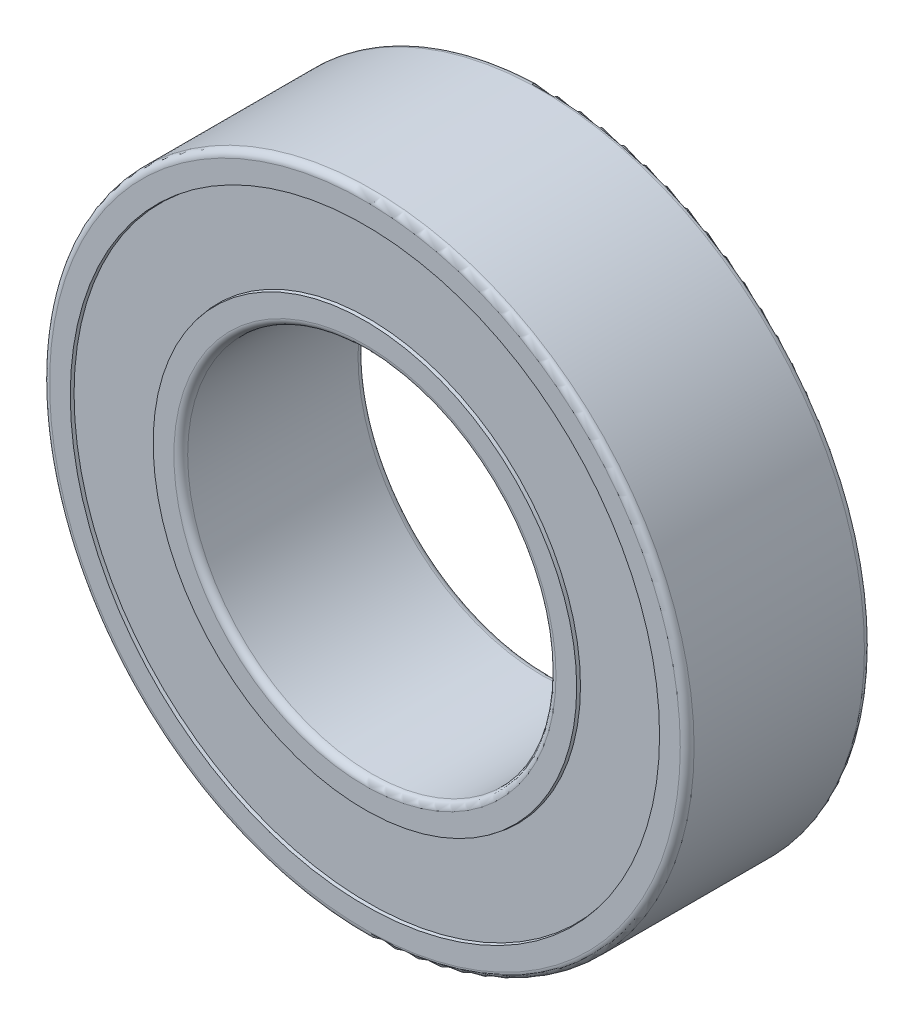
from build123d import *


with BuildPart() as part:
    # Sketch1 → Revolve1 (revolve)
    with BuildSketch(Plane(origin=(0, 0, 0), x_dir=(0, 0, -1), z_dir=(1, 0, 0)), mode=Mode.PRIVATE) as revolve1_sk:
        with BuildLine():
            Line((-1.85, 7), (1.85, 7))
            ThreePointArc((1.85, 7), (1.956066017, 6.956066017), (2, 6.85))
            Line((2, 6.85), (2, 6.4))
            Line((2, 6.4), (1.93, 6.387657111))
            Line((1.93, 6.387657111), (1.93, 4.612342889))
            Line((1.93, 4.612342889), (2, 4.6))
            Line((2, 4.6), (2, 4.15))
            ThreePointArc((2, 4.15), (1.956066017, 4.043933983), (1.85, 4))
            Line((1.85, 4), (-1.85, 4))
            ThreePointArc((-1.85, 4), (-1.956066017, 4.043933983), (-2, 4.15))
            Line((-2, 4.15), (-2, 4.6))
            Line((-2, 4.6), (-1.93, 4.612342889))
            Line((-1.93, 4.612342889), (-1.93, 6.387657111))
            Line((-1.93, 6.387657111), (-2, 6.4))
            Line((-2, 6.4), (-2, 6.85))
            ThreePointArc((-2, 6.85), (-1.956066017, 6.956066017), (-1.85, 7))
        make_face()
    revolve(revolve1_sk.sketch.rotate(Axis((0, 0, 0), (0, 0, -1)), 90), axis=Axis((0, 0, 0), (0, 0, -1)))


solid = part.part
